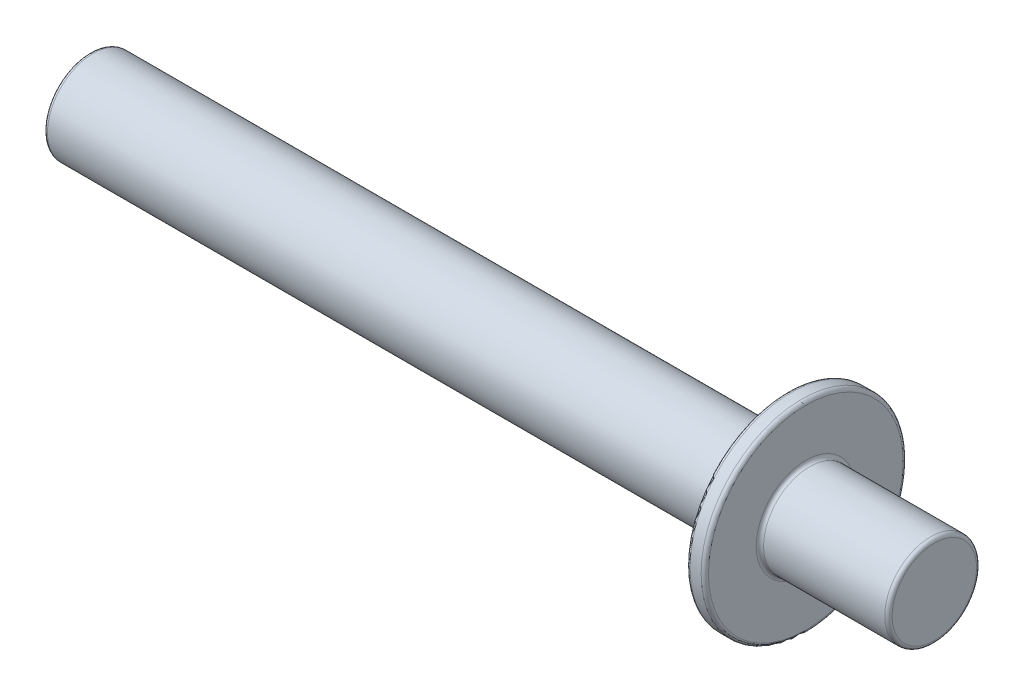
from build123d import *

# Parameters (mm, degrees)
CONG_1_R = 0.2


with BuildPart() as part:
    # Esquisse1 → Révolution1 (revolve)
    with BuildSketch(Plane.XY, mode=Mode.PRIVATE) as r_volution1_sk:
        Polygon((-46, 0), (-46, 2.5), (-8, 2.5), (-8, 5.5), (-7, 5.5), (-7, 2.5), (0, 2.5), (0, 0), align=None)
    revolve(r_volution1_sk.sketch.rotate(Axis((-86.086708861, 0, 0), (1, 0, 0)), 90), axis=Axis((-86.086708861, 0, 0), (1, 0, 0)))

    # Congé1
    cong_1_edges = [part.edges().sort_by_distance(p)[0] for p in [
        (-46, 0, -2.5),
        (-8, 0, -2.5),
        (-8, 0, -5.5),
        (-7, 0, -5.5),
        (-7, 0, -2.5),
        (0, 0, -2.5),
    ]]
    fillet(cong_1_edges, radius=CONG_1_R)


solid = part.part
